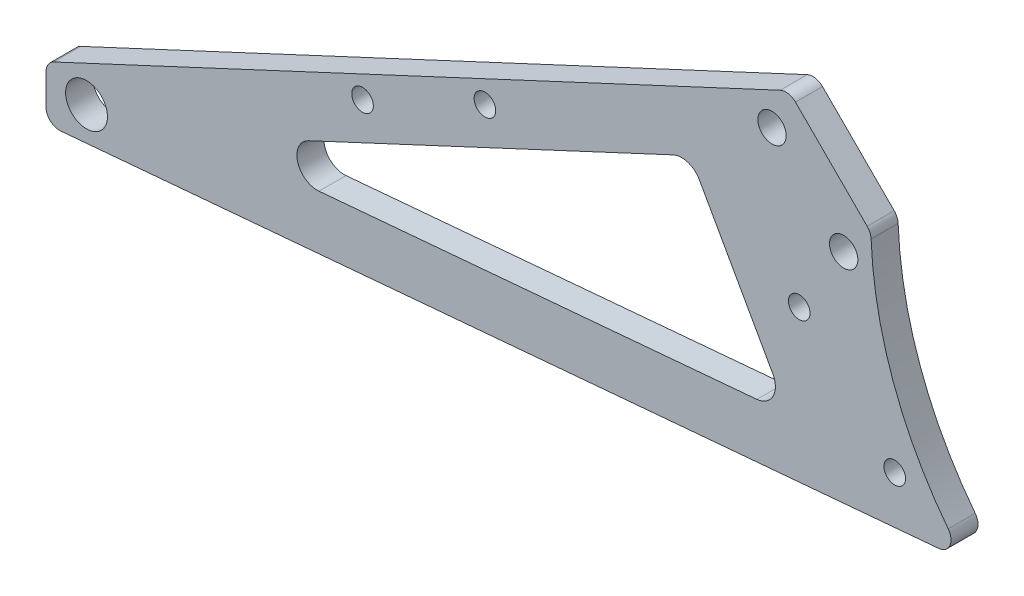
from build123d import *

# Parameters (mm, degrees)
SKETCH_1_R          = 3.1
SKETCH_1_R_2        = 2.1
SKETCH_1_R_3        = 1.6
EXTRUDE_1_DEPTH     = 4
FILLET_2_R          = 2
SKETCH_2_R          = 1.6
CUT_EXTRUDE_1_DEPTH = 20
CUT_EXTRUDE_2_DEPTH = 10
FILLET_3_R          = 3


with BuildPart() as part:
    # 草图1 → 凸台-拉伸1 (new body)
    with BuildSketch(Plane.XY):
        with BuildLine():
            Line((25.982574674, -47.286360788), (-110, -59.293842397))
            Line((-110, -59.293842397), (-110, -51.293842397))
            Line((-110, -51.293842397), (0, 0))
            Line((0, 0), (12.161955086, -12.161955086))
            ThreePointArc((12.161955086, -12.161955086), (15.964760057, -30.946887294), (25.982574674, -47.286360788))
        make_face()
        with Locations((-104, -53.81375969)):
            Circle(SKETCH_1_R, mode=Mode.SUBTRACT)
        with Locations((-2.485281374, -6)):
            Circle(SKETCH_1_R_2, mode=Mode.SUBTRACT)
        with Locations((8.121320344, -16.606601718)):
            Circle(SKETCH_1_R_2, mode=Mode.SUBTRACT)
        with Locations((1.544155877, -27)):
            Circle(SKETCH_1_R_3, mode=Mode.SUBTRACT)
        with Locations((15.686291501, -41.142135624)):
            Circle(SKETCH_1_R_3, mode=Mode.SUBTRACT)
    extrude(amount=EXTRUDE_1_DEPTH)

    # 圆角2
    fillet_2_edges = [part.edges().sort_by_distance(p)[0] for p in [
        (12.161955086, -12.161955086, 2),
        (25.982574674, -47.286360788, 2),
        (-110, -59.293842397, 2),
        (-110, -51.293842397, 2),
        (0, 0, 2),
    ]]
    fillet(fillet_2_edges, radius=FILLET_2_R)

    # 草图2 → 切除-拉伸1 (cut)
    with BuildSketch(Plane.XY.offset(4)):
        with Locations((-45, -24.293978374)):
            Circle(SKETCH_2_R)
        with Locations((-63.126155741, -32.746343609)):
            Circle(SKETCH_2_R)
    extrude(amount=-CUT_EXTRUDE_1_DEPTH, mode=Mode.SUBTRACT)

    # 草图3 → 切除-拉伸2 (cut)
    with BuildSketch(Plane.XY.offset(4)):
        Polygon((-14.605360146, -15.637614638), (-86.566111127, -49.193463907), (-0.110692732, -41.559310422), align=None)
    extrude(amount=-CUT_EXTRUDE_2_DEPTH, mode=Mode.SUBTRACT)

    # 圆角3
    fillet_3_edges = [part.edges().sort_by_distance(p)[0] for p in [
        (-14.605360146, -15.637614638, 2),
        (-0.110692732, -41.559310422, 2),
        (-86.566111127, -49.193463907, 2),
    ]]
    fillet(fillet_3_edges, radius=FILLET_3_R)


solid = part.part
